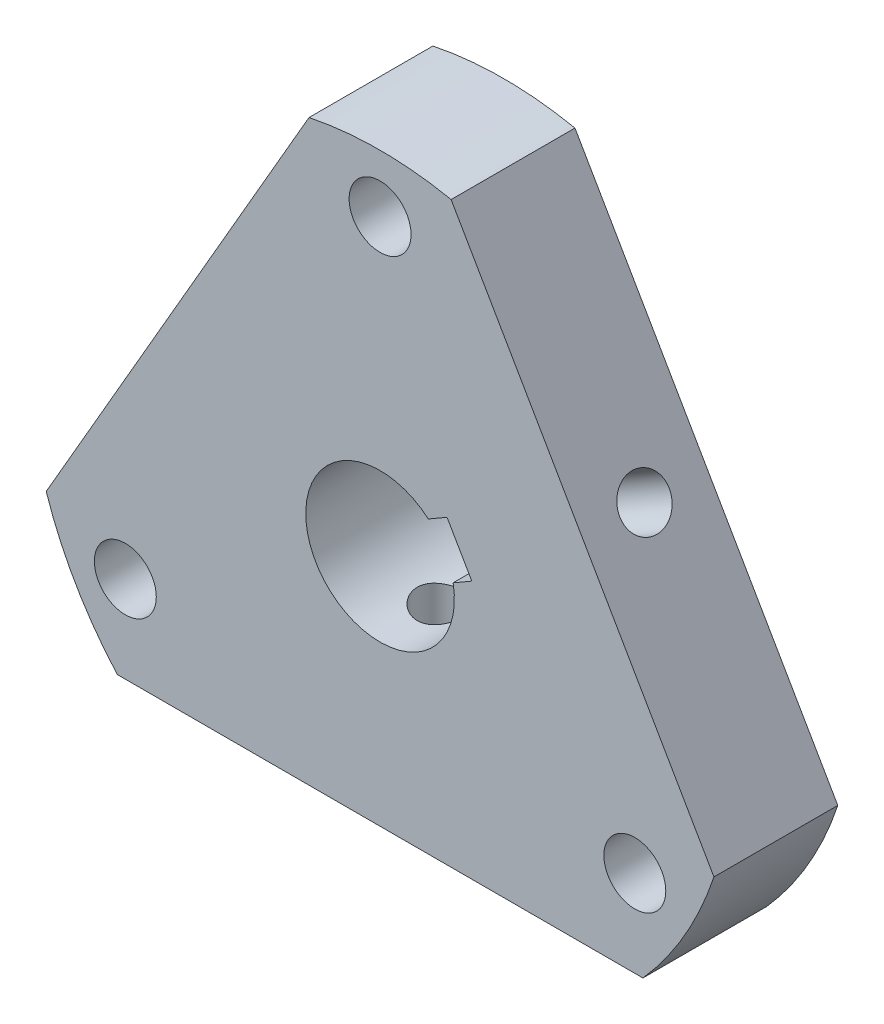
from build123d import *

# Parameters (mm, degrees)
SKETCH_1_R          = 2.5
EXTRUDE_1_DEPTH     = 10
SKETCH_2_R          = 2
CUT_EXTRUDE_1_DEPTH = 15
SKETCH_3_R          = 2
CUT_EXTRUDE_2_DEPTH = 15


with BuildPart() as part:
    # ｽｹｯﾁ1 → ﾎﾞｽ - 押し出し1 (new body)
    with BuildSketch(Plane.XY):
        with BuildLine():
            ThreePointArc((5.736159103, 27.814680993), (0, 28.4), (-5.736159103, 27.814680993))
            Line((-5.736159103, 27.814680993), (-26.95629989, -8.939680993))
            ThreePointArc((-26.95629989, -8.939680993), (-24.595121467, -14.2), (-21.220140787, -18.875))
            Line((-21.220140787, -18.875), (21.220140787, -18.875))
            ThreePointArc((21.220140787, -18.875), (24.595121467, -14.2), (26.95629989, -8.939680993))
            Line((26.95629989, -8.939680993), (5.736159103, 27.814680993))
        make_face()
        with Locations((-20.56810334, -11.875)):
            Circle(SKETCH_1_R, mode=Mode.SUBTRACT)
        with Locations((20.56810334, -11.875)):
            Circle(SKETCH_1_R, mode=Mode.SUBTRACT)
        with BuildLine():
            ThreePointArc((6, 0), (-5.449489743, -2.51058988), (3.898979486, 4.560477932))
            Line((3.898979486, 4.560477932), (5.408587988, 5.432050808))
            Line((5.408587988, 5.432050808), (7.408587988, 1.967949192))
            Line((7.408587988, 1.967949192), (5.898979486, 1.096376317))
            ThreePointArc((5.898979486, 1.096376317), (5.974691495, 0.550510257), (6, 0))
        make_face(mode=Mode.SUBTRACT)
        with Locations((0, 23.75)):
            Circle(SKETCH_1_R, mode=Mode.SUBTRACT)
    extrude(amount=EXTRUDE_1_DEPTH)

    # ｽｹｯﾁ2 → ｶｯﾄ - 押し出し1 (cut)
    with BuildSketch(Plane(origin=(16.346229496, 9.4375, 0), x_dir=(0, 0, -1), z_dir=(0.8660254037844386, 0.5, 0))):
        with Locations(Location((-5, 0, 0), (0, 0, 90))):
            Circle(SKETCH_2_R)
    extrude(amount=-CUT_EXTRUDE_1_DEPTH, mode=Mode.SUBTRACT)

    # ｽｹｯﾁ3 → ｶｯﾄ - 押し出し2 (cut)
    with BuildSketch(Plane.XZ.offset(18.875)):
        with Locations((0, 5)):
            Circle(SKETCH_3_R)
    extrude(amount=-CUT_EXTRUDE_2_DEPTH, mode=Mode.SUBTRACT)


solid = part.part
